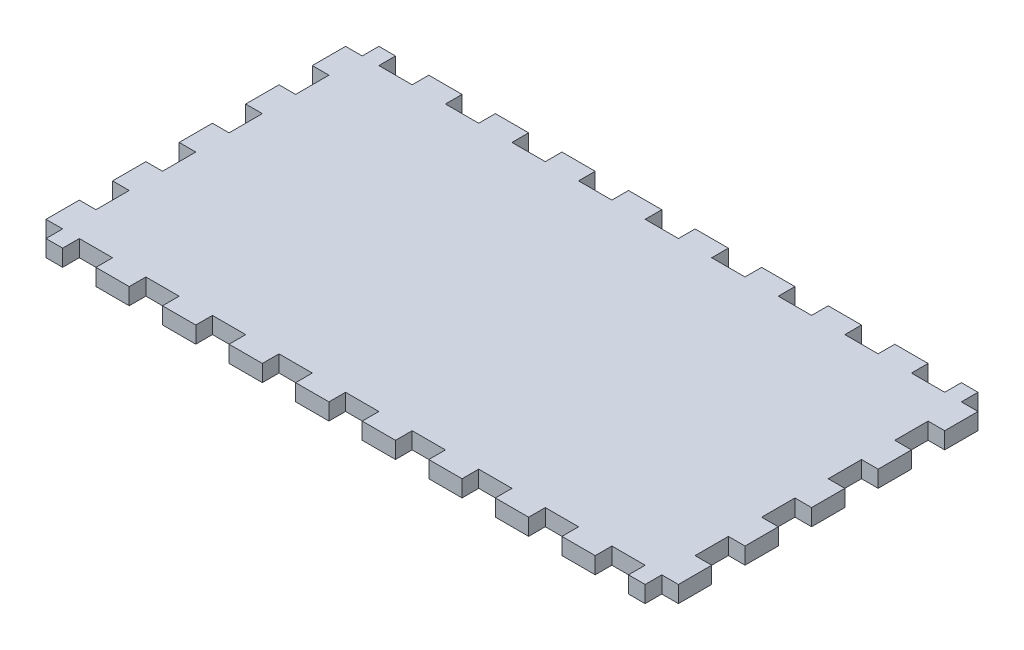
from build123d import *

# Parameters (mm, degrees)
BOSS_EXTRUDE3_DEPTH = 5


with BuildPart() as part:
    # Sketch2 → Boss-Extrude3 (new body)
    with BuildSketch(Plane(origin=(0, 0, 0), x_dir=(1, 0, 0), z_dir=(0, 1, 0))):
        Polygon((-4.018396485, -10), (-4.018396485, -20), (0.981603515, -20), (0.981603515, -30), (-4.018396485, -30), (-4.018396485, -40), (0.981603515, -40), (0.981603515, -50), (-4.018396485, -50), (-4.018396485, -60), (0.981603515, -60), (0.981603515, -70), (-4.018396485, -70), (-4.018396485, -80), (0.981603515, -80), (0.981603515, -90), (-4.018396485, -90), (-4.018396485, -95), (-9.018396485, -95), (-9.018396485, -90), (-19.018396485, -90), (-19.018396485, -95), (-29.018396485, -95), (-29.018396485, -90), (-39.018396485, -90), (-39.018396485, -95), (-49.018396485, -95), (-49.018396485, -90), (-59.018396485, -90), (-59.018396485, -95), (-69.018396485, -95), (-69.018396485, -90), (-79.018396485, -90), (-79.018396485, -95), (-89.018396485, -95), (-89.018396485, -90), (-99.018396485, -90), (-99.018396485, -95), (-109.018396485, -95), (-109.018396485, -90), (-119.018396485, -90), (-119.018396485, -95), (-129.018396485, -95), (-129.018396485, -90), (-139.018396485, -90), (-139.018396485, -95), (-149.018396485, -95), (-149.018396485, -90), (-159.018396485, -90), (-159.018396485, -95), (-169.018396485, -95), (-169.018396485, -90), (-179.018396485, -90), (-179.018396485, -95), (-184.018396485, -95), (-184.018396485, -90), (-189.018396485, -90), (-189.018396485, -80), (-184.018396485, -80), (-184.018396485, -70), (-189.018396485, -70), (-189.018396485, -60), (-184.018396485, -60), (-184.018396485, -50), (-189.018396485, -50), (-189.018396485, -40), (-184.018396485, -40), (-184.018396485, -30), (-189.018396485, -30), (-189.018396485, -20), (-184.018396485, -20), (-184.018396485, -10), (-189.018396485, -10), (-189.018396485, 0), (-184.018396485, 0), (-184.018396485, 5), (-179.018396485, 5), (-179.018396485, 0), (-169.018396485, 0), (-169.018396485, 5), (-159.018396485, 5), (-159.018396485, 0), (-149.018396485, 0), (-149.018396485, 5), (-139.018396485, 5), (-139.018396485, 0), (-129.018396485, 0), (-129.018396485, 5), (-119.018396485, 5), (-119.018396485, 0), (-109.018396485, 0), (-109.018396485, 5), (-99.018396485, 5), (-99.018396485, 0), (-89.018396485, 0), (-89.018396485, 5), (-79.018396485, 5), (-79.018396485, 0), (-69.018396485, 0), (-69.018396485, 5), (-59.018396485, 5), (-59.018396485, 0), (-49.018396485, 0), (-49.018396485, 5), (-39.018396485, 5), (-39.018396485, 0), (-29.018396485, 0), (-29.018396485, 5), (-19.018396485, 5), (-19.018396485, 0), (-9.018396485, 0), (-9.018396485, 5), (-4.018396485, 5), (-4.018396485, 0), (0.981603515, 0), (0.981603515, -10), align=None)
    extrude(amount=BOSS_EXTRUDE3_DEPTH)


solid = part.part
